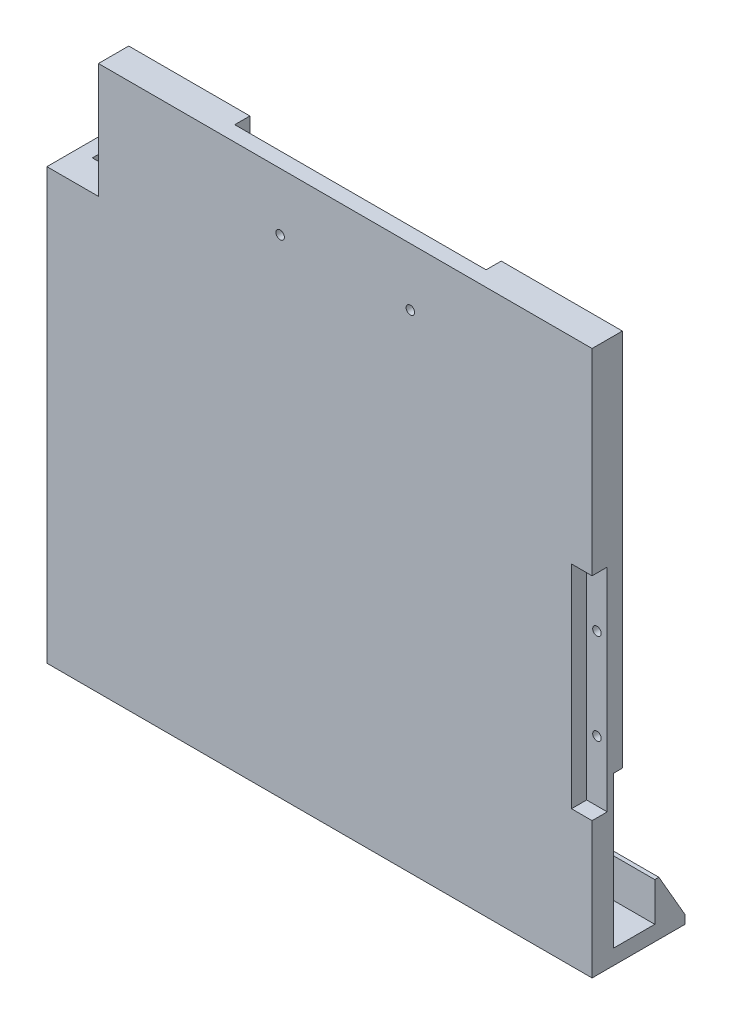
from build123d import *

# Parameters (mm, degrees)
CROQUIS1_W              = 180
CROQUIS1_H              = 180
SALIENTE_EXTRUIR1_DEPTH = 30.7
CROQUIS2_W              = 162.99
CROQUIS2_H              = 162.21
CORTAR_EXTRUIR1_DEPTH   = 20.7
CROQUIS4_W              = 175
CROQUIS4_H              = 10.7
CORTAR_EXTRUIR2_DEPTH   = 175
CORTAR_EXTRUIR3_REACH   = 258.403
CROQUIS5_W              = 30.7
CROQUIS5_H              = 38
CROQUIS6_W              = 82.99
CROQUIS6_H              = 38
CORTAR_EXTRUIR4_DEPTH   = 5
CROQUIS7_W              = 6.8
CROQUIS7_H              = 70
CORTAR_EXTRUIR5_DEPTH   = 5
CROQUIS8_W              = 175
CROQUIS8_H              = 50
CORTAR_EXTRUIR6_DEPTH   = 3
CHAFL_N1_SIZE           = 15
CHAFL_N1_SIZE2          = 8.660254038
CROQUIS9_R              = 1.4
CORTAR_EXTRUIR7_DEPTH   = 20


with BuildPart() as part:
    # Croquis1 → Saliente-Extruir1 (new body)
    with BuildSketch(Plane.XY):
        with Locations((90, 90)):
            Rectangle(CROQUIS1_W, CROQUIS1_H)
    extrude(amount=SALIENTE_EXTRUIR1_DEPTH)

    # Croquis2 → Cortar-Extruir1 (cut)
    with BuildSketch(Plane(origin=(0, 0, 0), x_dir=(-1, 0, 0), z_dir=(0, 0, -1))):
        with Locations((-98.505, 98.895)):
            Rectangle(CROQUIS2_W, CROQUIS2_H)
    extrude(amount=-CORTAR_EXTRUIR1_DEPTH, mode=Mode.SUBTRACT)

    # Croquis4 → Cortar-Extruir2 (cut)
    with BuildSketch(Plane(origin=(0, 180, 0), x_dir=(1, 0, 0), z_dir=(0, 1, 0))):
        with Locations((92.5, -15.35)):
            Rectangle(CROQUIS4_W, CROQUIS4_H)
    extrude(amount=-CORTAR_EXTRUIR2_DEPTH, mode=Mode.SUBTRACT)

    # Cortar-Extruir3: up to this face of the body (flat: up to its plane)
    cortar_extruir3_end = Plane(part.part.faces().sort_by_distance((17.01, 98.895, 5))[0])
    # Croquis5 → Cortar-Extruir3 (cut, up to the picked face)
    with BuildSketch(Plane.ZY, mode=Mode.PRIVATE) as cortar_extruir3_sk1:
        with Locations((15.35, 161)):
            Rectangle(CROQUIS5_W, CROQUIS5_H)
    cortar_extruir3_tool1 = split(extrude(cortar_extruir3_sk1.sketch, amount=-CORTAR_EXTRUIR3_REACH, mode=Mode.PRIVATE), bisect_by=cortar_extruir3_end, keep=Keep.BOTH, mode=Mode.PRIVATE)
    add(cortar_extruir3_tool1.solids().sort_by(Axis((0, 161, 15.35), (1, 0, 0)))[0], mode=Mode.SUBTRACT)

    # Croquis6 → Cortar-Extruir4 (cut)
    with BuildSketch(Plane(origin=(0, 0, 20.7), x_dir=(-1, 0, 0), z_dir=(0, 0, -1))):
        with Locations((-98.505, 161)):
            Rectangle(CROQUIS6_W, CROQUIS6_H)
    extrude(amount=-CORTAR_EXTRUIR4_DEPTH, mode=Mode.SUBTRACT)

    # Croquis7 → Cortar-Extruir5 (cut)
    with BuildSketch(Plane.XY.offset(30.7)):
        with Locations((176.6, 80)):
            Rectangle(CROQUIS7_W, CROQUIS7_H)
    extrude(amount=-CORTAR_EXTRUIR5_DEPTH, mode=Mode.SUBTRACT)

    # Croquis8 → Cortar-Extruir6 (cut)
    with BuildSketch(Plane(origin=(0, 0, 20.7), x_dir=(-1, 0, 0), z_dir=(0, 0, -1))):
        with Locations((-92.5, 30)):
            Rectangle(CROQUIS8_W, CROQUIS8_H)
    extrude(amount=-CORTAR_EXTRUIR6_DEPTH, mode=Mode.SUBTRACT)

    # Chaflán1
    chafl_n1_edges = [part.edges().sort_by_distance(p)[0] for p in [
        (98.505, 17.79, 0),
        (17.01, 79.895, 0),
    ]]
    chafl_n1_side = [part.faces().sort_by_distance(p)[0] for p in [
        (8.505, 139.707315983, 0),
    ]]
    chamfer(chafl_n1_edges, length=CHAFL_N1_SIZE, length2=CHAFL_N1_SIZE2, reference=chafl_n1_side[0])

    # Croquis9 → Cortar-Extruir7 (cut)
    with BuildSketch(Plane.XY.offset(30.7)):
        with Locations((176.6, 65)):
            Circle(CROQUIS9_R)
        with Locations((176.6, 95)):
            Circle(CROQUIS9_R)
        with Locations((120, 161)):
            Circle(CROQUIS9_R)
        with Locations((77.01, 161)):
            Circle(CROQUIS9_R)
    extrude(amount=-CORTAR_EXTRUIR7_DEPTH, mode=Mode.SUBTRACT)


solid = part.part
